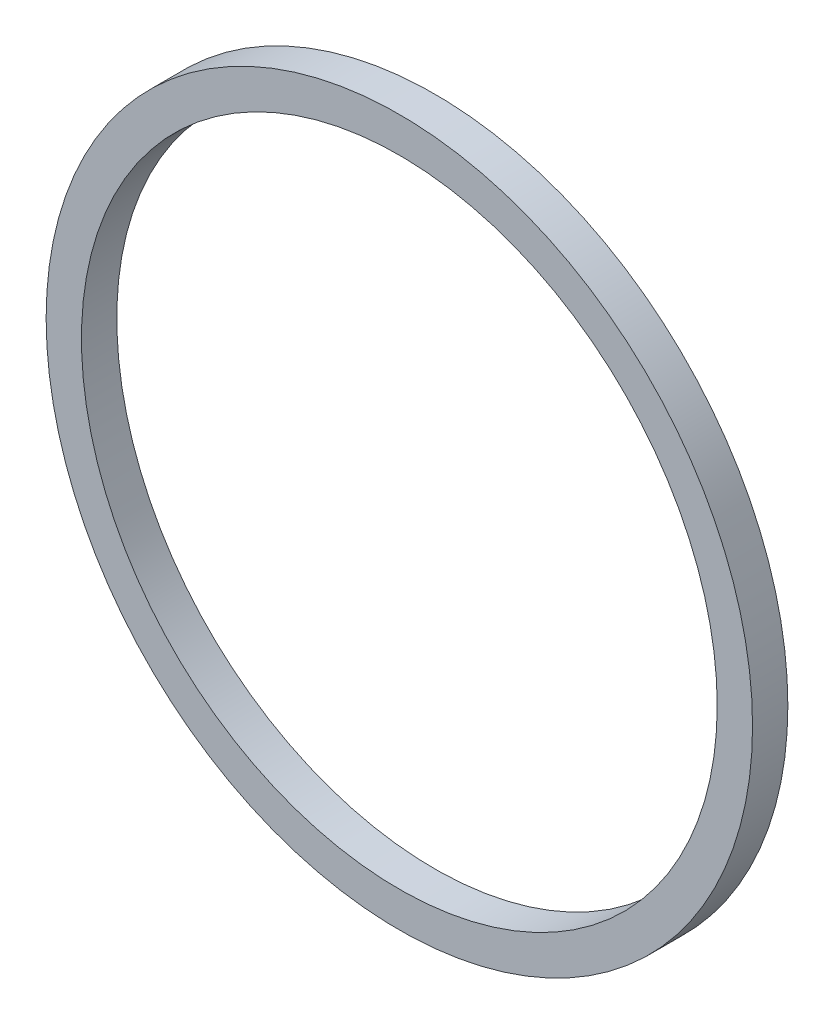
from build123d import *

# Parameters (mm, degrees)
SKETCH_1_R      = 63.5
SKETCH_1_R_2    = 57.15
EXTRUDE_1_DEPTH = 6.35


with BuildPart() as part:
    # 草图1 → 凸台-拉伸1 (new body)
    with BuildSketch(Plane.XY):
        Circle(SKETCH_1_R)
        Circle(SKETCH_1_R_2, mode=Mode.SUBTRACT)
    extrude(amount=EXTRUDE_1_DEPTH)


solid = part.part
